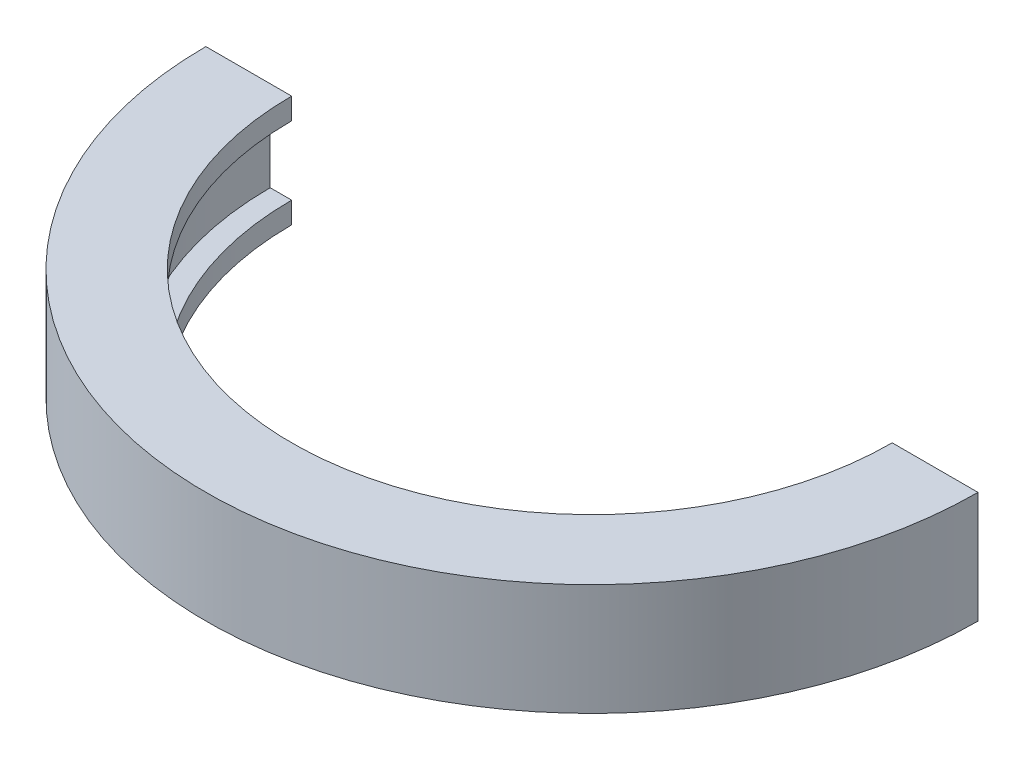
from build123d import *

# Parameters (mm, degrees)
BOSS_EXTRUDE1_DEPTH = 13
SKETCH2_W           = 5
SKETCH2_H           = 16


with BuildPart() as part:
    # Sketch1 → Boss-Extrude1 (new, symmetric)
    with BuildSketch(Plane(origin=(0, 0, 0), x_dir=(1, 0, 0), z_dir=(0, 1, 0))):
        with BuildLine():
            Line((-59.191435728, -3.155996626), (-79.191435728, -3.155996626))
            ThreePointArc((-79.191435728, -3.155996626), (10.808564272, -93.155996626), (100.808564272, -3.155996626))
            Line((100.808564272, -3.155996626), (80.808564272, -3.155996626))
            ThreePointArc((80.808564272, -3.155996626), (10.808564272, -73.155996626), (-59.191435728, -3.155996626))
        make_face()
    extrude(amount=BOSS_EXTRUDE1_DEPTH, both=True)

    # Sketch2 → Cut-Revolve1 (revolve, cut)
    with BuildSketch(Plane(origin=(0, 0, 3.155996626), x_dir=(-1, 0, 0), z_dir=(0, 0, -1))):
        with Locations((61.691435728, 0)):
            Rectangle(SKETCH2_W, SKETCH2_H)
    revolve(axis=Axis((10.808564272, 13, 3.155996626), (0, -1, 0)), mode=Mode.SUBTRACT)


solid = part.part
